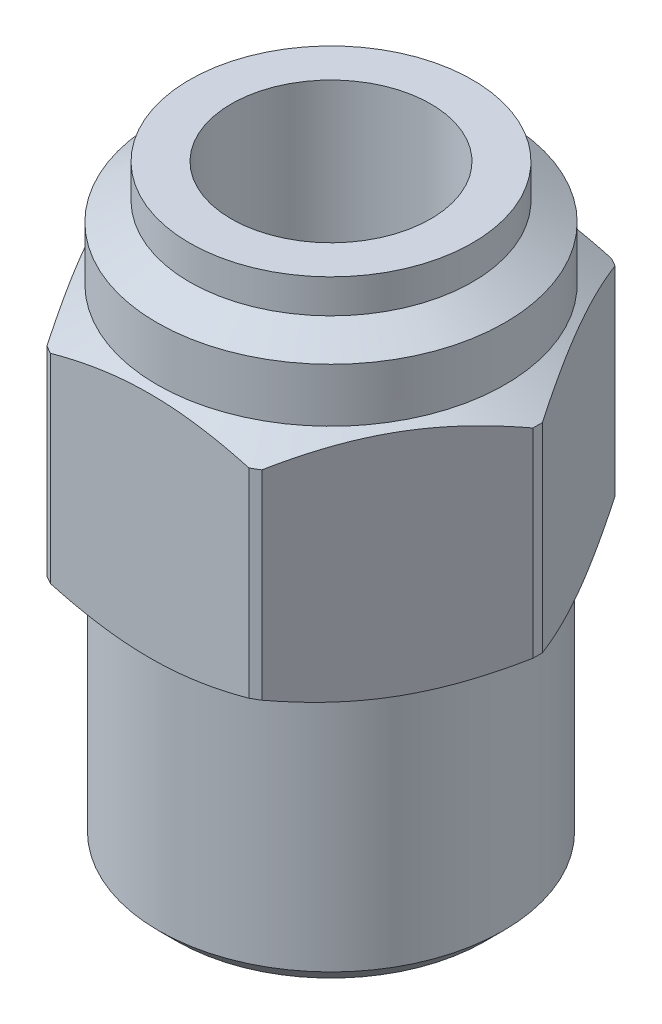
from build123d import *

# Parameters (mm, degrees)
CUT_EXTRUDE1_DEPTH = 19.363823131
CHAMFER1_SIZE      = 0.5


with BuildPart() as part:
    # Sketch1 → Revolve1 (revolve)
    with BuildSketch(Plane(origin=(0, 0, 0), x_dir=(0, 0, -1), z_dir=(1, 0, 0)), mode=Mode.PRIVATE) as revolve1_sk:
        Polygon((4.75, 0), (4.75, 7), (5.7, 7.548482756), (5.7, 13.048482756), (4.8, 13.568097998), (4.8, 15.048482756), (3.9, 15.568097998), (3.9, 16.5), (2.75, 16.5), (2.75, 10.298482756), (2.2, 9.980940108), (2.2, 4.235085296), (3.3, 3.6), (3.3, 0), align=None)
    revolve(revolve1_sk.sketch.rotate(Axis((0, 19.630565864, 0), (0, -1, 0)), 180), axis=Axis((0, 19.630565864, 0), (0, -1, 0)))

    # Sketch2 → Cut-Extrude1 (cut, through all)
    with BuildSketch(Plane(origin=(0, 16.5, 0), x_dir=(1, 0, 0), z_dir=(0, 1, 0))):
        with BuildLine():
            Line((-2.886751346, 5), (2.886751346, 5))
            ThreePointArc((2.886751346, 5), (0, 5.773502692), (-2.886751346, 5))
        make_face()
        with BuildLine():
            Line((-5.773502692, 0), (-2.886751346, 5))
            ThreePointArc((-2.886751346, 5), (-5, 2.886751346), (-5.773502692, 0))
        make_face()
        with BuildLine():
            Line((-2.886751346, -5), (-5.773502692, 0))
            ThreePointArc((-5.773502692, 0), (-5, -2.886751346), (-2.886751346, -5))
        make_face()
        with BuildLine():
            ThreePointArc((-2.886751346, -5), (0, -5.773502692), (2.886751346, -5))
            Line((2.886751346, -5), (-2.886751346, -5))
        make_face()
        with BuildLine():
            ThreePointArc((2.886751346, -5), (5, -2.886751346), (5.773502692, 0))
            Line((5.773502692, 0), (2.886751346, -5))
        make_face()
        with BuildLine():
            ThreePointArc((5.773502692, 0), (5, 2.886751346), (2.886751346, 5))
            Line((2.886751346, 5), (5.773502692, 0))
        make_face()
    extrude(amount=-CUT_EXTRUDE1_DEPTH, mode=Mode.SUBTRACT)

    # Chamfer1
    chamfer1_edges = [part.edges().sort_by_distance(p)[0] for p in [
        (0, 0, -4.75),
    ]]
    chamfer(chamfer1_edges, length=CHAMFER1_SIZE)


solid = part.part
